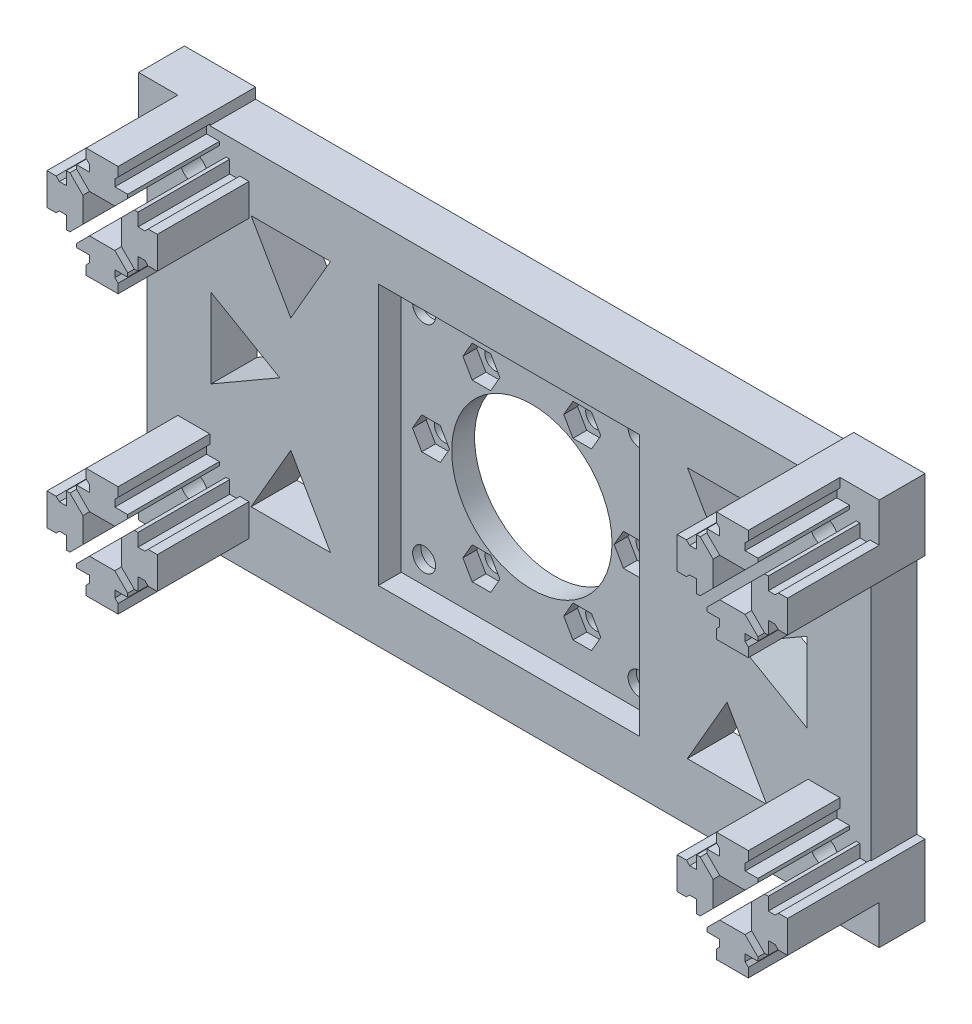
from build123d import *

# Parameters (mm, degrees)
ESQUISSE1_W                  = 158
ESQUISSE1_H                  = 80
ESQUISSE1_R                  = 2.25
ESQUISSE1_R_2                = 2.5
ESQUISSE1_R_3                = 17.5
BOSS_EXTRU_1_DEPTH           = 10
ESQUISSE2_R                  = 3
ENL_V_MAT_EXTRU_1_DEPTH      = 10
ENL_V_MAT_EXTRU_3_DEPTH      = 10
ESQUISSE5_W                  = 57
ESQUISSE5_H                  = 57
ENL_V_MAT_EXTRU_4_DEPTH      = 5
ENL_V_MAT_EXTRU_5_DEPTH      = 3
BOSS_EXTRU_2_DEPTH           = 20
R_P_TITION_CIRCULAIRE1_COUNT = 2
SYM_TRIE2_COPY_1_DEPTH       = 20
SYM_TRIE2_COPY_2_DEPTH       = 20
BOSS_EXTRU_3_DEPTH           = 10
ESQUISSE12_R                 = 4.25
ESQUISSE12_R_2               = 5.5
ENL_V_MAT_EXTRU_6_DEPTH      = 3.2


with BuildPart() as part:
    # Esquisse1 → Boss.-Extru.1 (new body)
    with BuildSketch(Plane.XY):
        Rectangle(ESQUISSE1_W, ESQUISSE1_H)
        with Locations((22, 0)):
            Circle(ESQUISSE1_R, mode=Mode.SUBTRACT)
        with Locations((11, -19.052558883)):
            Circle(ESQUISSE1_R, mode=Mode.SUBTRACT)
        with Locations((-11, -19.052558883)):
            Circle(ESQUISSE1_R, mode=Mode.SUBTRACT)
        with Locations((-22, 0)):
            Circle(ESQUISSE1_R, mode=Mode.SUBTRACT)
        with Locations((-11, 19.052558883)):
            Circle(ESQUISSE1_R, mode=Mode.SUBTRACT)
        with Locations((11, 19.052558883)):
            Circle(ESQUISSE1_R, mode=Mode.SUBTRACT)
        with Locations((-23.5, 23.55)):
            Circle(ESQUISSE1_R_2, mode=Mode.SUBTRACT)
        with Locations((23.5, 23.55)):
            Circle(ESQUISSE1_R_2, mode=Mode.SUBTRACT)
        with Locations((23.5, -23.55)):
            Circle(ESQUISSE1_R_2, mode=Mode.SUBTRACT)
        with Locations((-23.5, -23.55)):
            Circle(ESQUISSE1_R_2, mode=Mode.SUBTRACT)
        Circle(ESQUISSE1_R_3, mode=Mode.SUBTRACT)
    extrude(amount=BOSS_EXTRU_1_DEPTH)

    # Esquisse2 → Enlèv. mat.-Extru.1 (cut)
    with BuildSketch(Plane(origin=(0, 0, 0), x_dir=(-1, 0, 0), z_dir=(0, 0, -1))):
        with Locations((68.755, 30.26)):
            Circle(ESQUISSE2_R)
        with Locations((-68.755, 30.26)):
            Circle(ESQUISSE2_R)
        with Locations((68.755, -30.002799658)):
            Circle(ESQUISSE2_R)
        with Locations((-68.755, -30.002799658)):
            Circle(ESQUISSE2_R)
    extrude(amount=-ENL_V_MAT_EXTRU_1_DEPTH, mode=Mode.SUBTRACT)

    # Esquisse3 → Enlèv. mat.-Extru.3 (cut)
    with BuildSketch(Plane.XY.offset(10)):
        Polygon((-56.255270637, 27.5), (-47.5950166, 12.5), (-38.934762562, 27.5), align=None)
        Polygon((-65, -8.660254038), (-50, 0), (-65, 8.660254038), align=None)
        Polygon((-38.934762562, -27.5), (-47.5950166, -12.5), (-56.255270637, -27.5), align=None)
        Polygon((38.934762562, -27.5), (56.255270637, -27.5), (47.5950166, -12.5), align=None)
        Polygon((65, -8.660254038), (65, 8.660254038), (50, 0), align=None)
        Polygon((56.255270637, 27.5), (38.934762562, 27.5), (47.5950166, 12.5), align=None)
    extrude(amount=-ENL_V_MAT_EXTRU_3_DEPTH, mode=Mode.SUBTRACT)

    # Esquisse5 → Enlèv. mat.-Extru.4 (cut)
    with BuildSketch(Plane.XY.offset(10)):
        Rectangle(ESQUISSE5_W, ESQUISSE5_H)
    extrude(amount=-ENL_V_MAT_EXTRU_4_DEPTH, mode=Mode.SUBTRACT)

    # Esquisse6 → Enlèv. mat.-Extru.5 (cut)
    with BuildSketch(Plane.XY.offset(5)):
        Polygon((13.020725942, 15.552558883), (15.041451884, 19.052558883), (13.020725942, 22.552558883), (8.979274058, 22.552558883), (6.958548116, 19.052558883), (8.979274058, 15.552558883), align=None)
        Polygon((-6.958548116, 19.052558883), (-8.979274058, 22.552558883), (-13.020725942, 22.552558883), (-15.041451884, 19.052558883), (-13.020725942, 15.552558883), (-8.979274058, 15.552558883), align=None)
        Polygon((19.979274058, -3.5), (24.020725942, -3.5), (26.041451884, 0), (24.020725942, 3.5), (19.979274058, 3.5), (17.958548116, 0), align=None)
        Polygon((6.958548116, -19.052558883), (8.979274058, -22.552558883), (13.020725942, -22.552558883), (15.041451884, -19.052558883), (13.020725942, -15.552558883), (8.979274058, -15.552558883), align=None)
        Polygon((-13.020725942, -15.552558883), (-15.041451884, -19.052558883), (-13.020725942, -22.552558883), (-8.979274058, -22.552558883), (-6.958548116, -19.052558883), (-8.979274058, -15.552558883), align=None)
        Polygon((-19.979274058, 3.5), (-24.020725942, 3.5), (-26.041451884, 0), (-24.020725942, -3.5), (-19.979274058, -3.5), (-17.958548116, 0), align=None)
    extrude(amount=-ENL_V_MAT_EXTRU_5_DEPTH, mode=Mode.SUBTRACT)

    # Esquisse8 → Boss.-Extru.2 (add)
    with BuildSketch(Plane.XY.offset(10)):
        Polygon((-64.555, 27.51), (-64.555, 33.01), (-61.726572875, 35.838427125), (-60.926572875, 35.838427125), (-60.926572875, 33.038427125), (-59.426572875, 33.038427125), (-58.719466094, 33.745533906), (-56.719466094, 33.745533906), (-56.719466094, 26.774466094), (-58.719466094, 26.774466094), (-59.426572875, 27.481572875), (-60.926572875, 27.481572875), (-60.926572875, 24.681572875), (-61.726572875, 24.681572875), align=None)
        Polygon((-65.976572875, 20.931572875), (-65.269466094, 20.224466094), (-65.269466094, 18.224466094), (-72.240533906, 18.224466094), (-72.240533906, 20.224466094), (-71.533427125, 20.931572875), (-71.533427125, 22.431572875), (-74.333427125, 22.431572875), (-74.333427125, 23.231572875), (-71.505, 26.06), (-66.005, 26.06), (-63.176572875, 23.231572875), (-63.176572875, 22.431572875), (-65.976572875, 22.431572875), align=None)
        Polygon((-78.083427125, 27.481572875), (-78.790533906, 26.774466094), (-80.790533906, 26.774466094), (-80.790533906, 33.745533906), (-78.790533906, 33.745533906), (-78.083427125, 33.038427125), (-76.583427125, 33.038427125), (-76.583427125, 35.838427125), (-75.783427125, 35.838427125), (-72.955, 33.01), (-72.955, 27.51), (-75.783427125, 24.681572875), (-76.583427125, 24.681572875), (-76.583427125, 27.481572875), align=None)
        Polygon((-71.533427125, 39.588427125), (-72.240533906, 40.295533906), (-72.240533906, 42.295533906), (-65.269466094, 42.295533906), (-65.269466094, 40.295533906), (-65.976572875, 39.588427125), (-65.976572875, 38.088427125), (-63.176572875, 38.088427125), (-63.176572875, 37.288427125), (-66.005, 34.46), (-71.505, 34.46), (-74.333427125, 37.288427125), (-74.333427125, 38.088427125), (-71.533427125, 38.088427125), align=None)
    boss_extru_2 = extrude(amount=BOSS_EXTRU_2_DEPTH)

    # Répétition circulaire1: Boss.-Extru.2 ×2 about axis
    r_p_tition_circulaire1_axis = Axis((0, 0, 0), (0, 0, 1))
    for i in range(1, R_P_TITION_CIRCULAIRE1_COUNT):
        add(boss_extru_2.rotate(r_p_tition_circulaire1_axis, i * 360 / R_P_TITION_CIRCULAIRE1_COUNT))

    # Symétrie1: Boss.-Extru.2 across plane
    add(boss_extru_2.mirror(Plane(origin=(0, 0, 0), x_dir=(0, 0, 1), z_dir=(0, -1, 0))))

    # Symétrie2 copy 1 sketch → Symétrie2 copy 1 (add)
    with BuildSketch(Plane(origin=(0, 0, 10), x_dir=(-1, 0, 0), z_dir=(0, 0, 1))):
        Polygon((-64.555, -27.51), (-64.555, -33.01), (-61.726572875, -35.838427125), (-60.926572875, -35.838427125), (-60.926572875, -33.038427125), (-59.426572875, -33.038427125), (-58.719466094, -33.745533906), (-56.719466094, -33.745533906), (-56.719466094, -26.774466094), (-58.719466094, -26.774466094), (-59.426572875, -27.481572875), (-60.926572875, -27.481572875), (-60.926572875, -24.681572875), (-61.726572875, -24.681572875), align=None)
        Polygon((-65.976572875, -20.931572875), (-65.269466094, -20.224466094), (-65.269466094, -18.224466094), (-72.240533906, -18.224466094), (-72.240533906, -20.224466094), (-71.533427125, -20.931572875), (-71.533427125, -22.431572875), (-74.333427125, -22.431572875), (-74.333427125, -23.231572875), (-71.505, -26.06), (-66.005, -26.06), (-63.176572875, -23.231572875), (-63.176572875, -22.431572875), (-65.976572875, -22.431572875), align=None)
        Polygon((-78.083427125, -27.481572875), (-78.790533906, -26.774466094), (-80.790533906, -26.774466094), (-80.790533906, -33.745533906), (-78.790533906, -33.745533906), (-78.083427125, -33.038427125), (-76.583427125, -33.038427125), (-76.583427125, -35.838427125), (-75.783427125, -35.838427125), (-72.955, -33.01), (-72.955, -27.51), (-75.783427125, -24.681572875), (-76.583427125, -24.681572875), (-76.583427125, -27.481572875), align=None)
        Polygon((-71.533427125, -39.588427125), (-72.240533906, -40.295533906), (-72.240533906, -42.295533906), (-65.269466094, -42.295533906), (-65.269466094, -40.295533906), (-65.976572875, -39.588427125), (-65.976572875, -38.088427125), (-63.176572875, -38.088427125), (-63.176572875, -37.288427125), (-66.005, -34.46), (-71.505, -34.46), (-74.333427125, -37.288427125), (-74.333427125, -38.088427125), (-71.533427125, -38.088427125), align=None)
    extrude(amount=SYM_TRIE2_COPY_1_DEPTH)

    # Symétrie2 copy 2 sketch → Symétrie2 copy 2 (add)
    with BuildSketch(Plane.XY.offset(10)):
        Polygon((-64.555, -27.51), (-64.555, -33.01), (-61.726572875, -35.838427125), (-60.926572875, -35.838427125), (-60.926572875, -33.038427125), (-59.426572875, -33.038427125), (-58.719466094, -33.745533906), (-56.719466094, -33.745533906), (-56.719466094, -26.774466094), (-58.719466094, -26.774466094), (-59.426572875, -27.481572875), (-60.926572875, -27.481572875), (-60.926572875, -24.681572875), (-61.726572875, -24.681572875), align=None)
        Polygon((-65.976572875, -20.931572875), (-65.269466094, -20.224466094), (-65.269466094, -18.224466094), (-72.240533906, -18.224466094), (-72.240533906, -20.224466094), (-71.533427125, -20.931572875), (-71.533427125, -22.431572875), (-74.333427125, -22.431572875), (-74.333427125, -23.231572875), (-71.505, -26.06), (-66.005, -26.06), (-63.176572875, -23.231572875), (-63.176572875, -22.431572875), (-65.976572875, -22.431572875), align=None)
        Polygon((-78.083427125, -27.481572875), (-78.790533906, -26.774466094), (-80.790533906, -26.774466094), (-80.790533906, -33.745533906), (-78.790533906, -33.745533906), (-78.083427125, -33.038427125), (-76.583427125, -33.038427125), (-76.583427125, -35.838427125), (-75.783427125, -35.838427125), (-72.955, -33.01), (-72.955, -27.51), (-75.783427125, -24.681572875), (-76.583427125, -24.681572875), (-76.583427125, -27.481572875), align=None)
        Polygon((-71.533427125, -39.588427125), (-72.240533906, -40.295533906), (-72.240533906, -42.295533906), (-65.269466094, -42.295533906), (-65.269466094, -40.295533906), (-65.976572875, -39.588427125), (-65.976572875, -38.088427125), (-63.176572875, -38.088427125), (-63.176572875, -37.288427125), (-66.005, -34.46), (-71.505, -34.46), (-74.333427125, -37.288427125), (-74.333427125, -38.088427125), (-71.533427125, -38.088427125), align=None)
    extrude(amount=SYM_TRIE2_COPY_2_DEPTH)

    # Esquisse11 → Boss.-Extru.3 (add)
    with BuildSketch(Plane(origin=(0, 0, 0), x_dir=(-1, 0, 0), z_dir=(0, 0, -1))):
        Polygon((65.269466094, 42.295533906), (72.309712288, 42.295533906), (80.790533906, 42.295533906), (80.790533906, 33.745533906), (80.790533906, 26.774466094), (79, 26.774466094), (79, 33.745533906), (72.309712288, 33.745533906), (72.309712288, 40), (65.269466094, 40), align=None)
        Polygon((65.269466094, -42.295533906), (72.240533906, -42.295533906), (80.790533906, -42.295533906), (80.790533906, -33.745533906), (80.790533906, -26.774466094), (79, -26.774466094), (79, -33.745533906), (72.240533906, -33.745533906), (72.240533906, -40), (65.269466094, -40), align=None)
        Polygon((-80.790533906, -26.774466094), (-79, -26.774466094), (-79, -33.745533906), (-72.240533906, -33.745533906), (-72.240533906, -40), (-65.240533906, -40), (-65.240533906, -42.295533906), (-72.240533906, -42.295533906), (-80.790533906, -42.295533906), (-80.790533906, -33.745533906), align=None)
        Polygon((-72.240533906, 42.295533906), (-65.240533906, 42.295533906), (-65.240533906, 40), (-72.240533906, 40), (-72.240533906, 33.745533906), (-79, 33.745533906), (-79, 26.774466094), (-80.790533906, 26.774466094), (-80.790533906, 33.745533906), (-80.790533906, 42.295533906), align=None)
    extrude(amount=-BOSS_EXTRU_3_DEPTH)

    # Esquisse12 → Enlèv. mat.-Extru.6 (cut)
    with BuildSketch(Plane(origin=(0, 0, 0), x_dir=(-1, 0, 0), z_dir=(0, 0, -1))):
        with Locations((-23.5, 23.55)):
            Circle(ESQUISSE12_R)
        with Locations((23.55, 23.5)):
            Circle(ESQUISSE12_R)
        with Locations((23.5, -23.55)):
            Circle(ESQUISSE12_R)
        with Locations((-23.55, -23.5)):
            Circle(ESQUISSE12_R)
        with Locations((-68.755, 30.26)):
            Circle(ESQUISSE12_R_2)
        with Locations(Location((-68.755, -30.26, 0), (0, 0, 180))):
            Circle(ESQUISSE12_R_2)
        with Locations((68.755, -30.26)):
            Circle(ESQUISSE12_R_2)
        with Locations(Location((68.755, 30.26, 0), (0, 0, 180))):
            Circle(ESQUISSE12_R_2)
    extrude(amount=-ENL_V_MAT_EXTRU_6_DEPTH, mode=Mode.SUBTRACT)


solid = part.part
